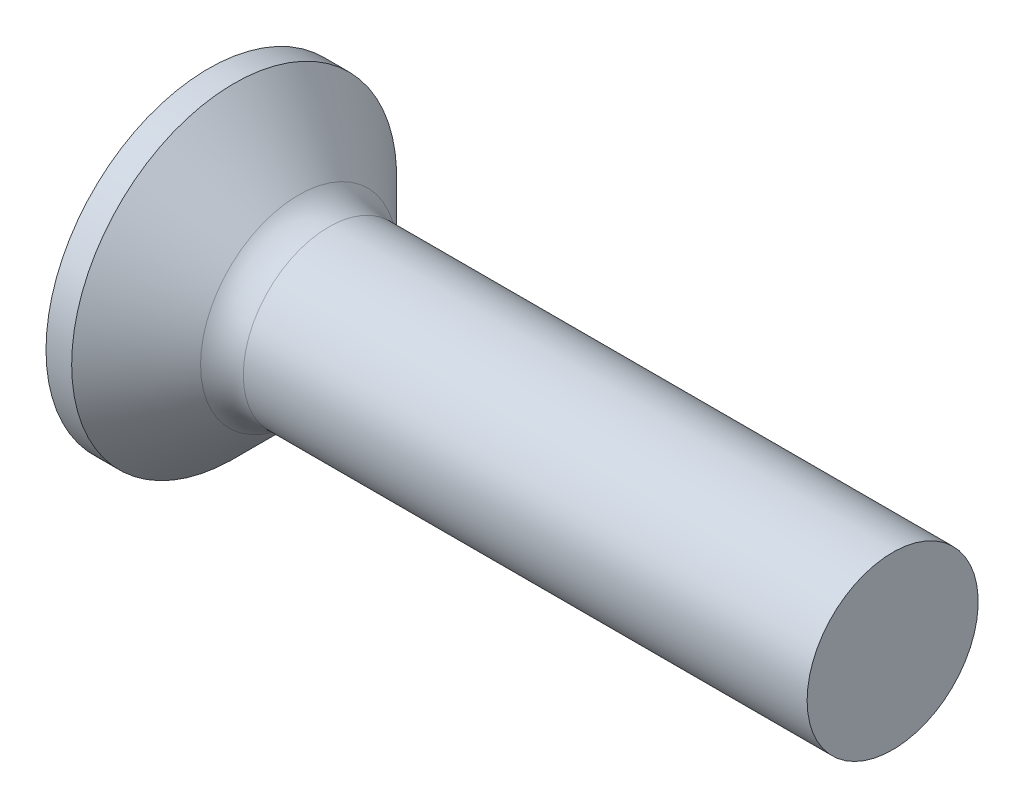
from build123d import *

# Parameters (mm, degrees)
FILLET1_R    = 0.5
RECPAT_COUNT = 2
RECPAT_ANGLE = 90


with BuildPart() as part:
    # BodySke → Base-Revolve (revolve)
    with BuildSketch(Plane.XY, mode=Mode.PRIVATE) as base_revolve_sk:
        Polygon((0, 0), (0, 1.9), (0.3, 1.9), (1.2, 1), (8, 1), (8, 0), align=None)
    revolve(base_revolve_sk.sketch.rotate(Axis((-6.35, 0, 0), (1, 0, 0)), 90), axis=Axis((-6.35, 0, 0), (1, 0, 0)))

    # Fillet1
    fillet1_edges = [part.edges().sort_by_distance(p)[0] for p in [
        (1.2, 0, -1),
    ]]
    fillet(fillet1_edges, radius=FILLET1_R)

    # Sketch3 → Recess section 0
    with BuildSketch(Plane.ZY):
        with BuildLine():
            Line((-0.24, 0.95), (0.24, 0.95))
            Line((0.24, 0.95), (0.24, -0.95))
            Line((0.24, -0.95), (-0.24, -0.95))
            Line((-0.24, -0.95), (-0.24, 0.95))
        make_face()
    # Sketch4 → Recess section 1
    with BuildSketch(Plane.ZY.offset(-1.2)):
        with BuildLine():
            Line((-0.24, 0.35170217), (0.24, 0.35170217))
            Line((0.24, 0.35170217), (0.24, -0.35170217))
            Line((0.24, -0.35170217), (-0.24, -0.35170217))
            Line((-0.24, -0.35170217), (-0.24, 0.35170217))
        make_face()
    recess = loft(mode=Mode.SUBTRACT)

    # RecPat: Recess ×2 about axis
    recpat_axis = Axis((0, 0, 0), (1, 0, 0))
    for i in range(1, RECPAT_COUNT):
        add(recess.rotate(recpat_axis, i * RECPAT_ANGLE / (RECPAT_COUNT - 1)), mode=Mode.SUBTRACT)

    # RecCorSke → RecessCore (revolve, cut)
    with BuildSketch(Plane.XY, mode=Mode.PRIVATE) as recesscore_sk:
        Polygon((0, 0), (0, 0.439412174), (1.2, 0.3555), (1.315508952, 0), align=None)
    revolve(recesscore_sk.sketch.rotate(Axis((-3.175, 0, 0), (1, 0, 0)), 90), axis=Axis((-3.175, 0, 0), (1, 0, 0)), mode=Mode.SUBTRACT)


solid = part.part
